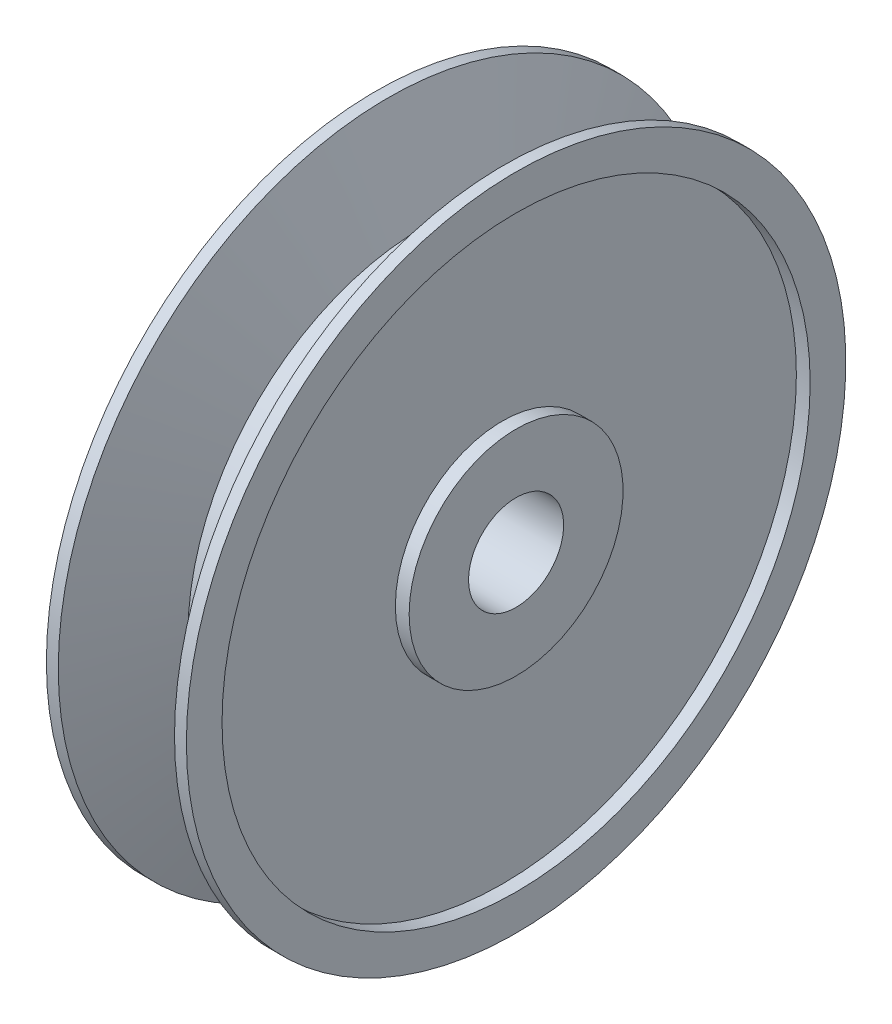
from build123d import *


with BuildPart() as part:
    # Sketch1 → Revolve1 (revolve)
    with BuildSketch(Plane.XY, mode=Mode.PRIVATE) as revolve1_sk:
        Polygon((0, 4), (5.89, 4), (5.89, 9), (4.730911447, 9), (4.730911447, 24.74), (5.89, 24.74), (5.89, 27.74), (0, 27.74), align=None)
    revolve1 = revolve(revolve1_sk.sketch.rotate(Axis((0, 0, 0), (1, 0, 0)), 90), axis=Axis((0, 0, 0), (1, 0, 0)))

    # Sketch2 → Cut-Revolve1 (revolve, cut)
    with BuildSketch(Plane.XY, mode=Mode.PRIVATE) as cut_revolve1_sk:
        Polygon((0, 19.74), (1.977829822, 19.74), (4.889591697, 27.74), (0, 27.74), align=None)
    cut_revolve1 = revolve(cut_revolve1_sk.sketch.rotate(Axis((0, 0, 0), (1, 0, 0)), 90), axis=Axis((0, 0, 0), (1, 0, 0)), mode=Mode.SUBTRACT)

    # Mirror1: Revolve1, Cut-Revolve1 across plane
    add(revolve1.mirror(Plane(origin=(0, 27.74, 0), x_dir=(0, 0, 1), z_dir=(1, 0, 0))))
    add(cut_revolve1.mirror(Plane(origin=(0, 27.74, 0), x_dir=(0, 0, 1), z_dir=(1, 0, 0))), mode=Mode.SUBTRACT)


solid = part.part
